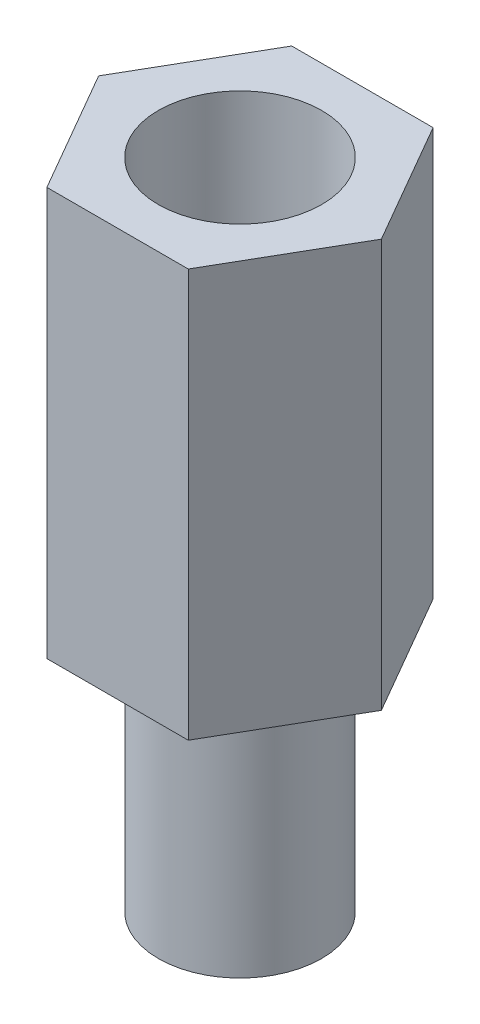
from build123d import *

# Parameters (mm, degrees)
SKETCH_2_R      = 2
EXTRUDE_1_DEPTH = 10
SKETCH_2_2_R    = 2
EXTRUDE_2_DEPTH = 6


with BuildPart() as part:
    # 草图2 → 凸台-拉伸1 (new body)
    with BuildSketch(Plane(origin=(0, 0, 0), x_dir=(1, 0, 0), z_dir=(0, 1, 0))):
        Polygon((3.464101615, 0), (1.732050808, 3), (-1.732050808, 3), (-3.464101615, 0), (-1.732050808, -3), (1.732050808, -3), align=None)
        Circle(SKETCH_2_R, mode=Mode.SUBTRACT)
    extrude(amount=EXTRUDE_1_DEPTH)


with BuildPart() as body_2:
    # 草图2<2> → 凸台-拉伸2 (new body)
    with BuildSketch(Plane(origin=(0, 0, 0), x_dir=(1, 0, 0), z_dir=(0, 1, 0))):
        Circle(SKETCH_2_2_R)
    extrude(amount=-EXTRUDE_2_DEPTH)


solid = Compound([part.part, body_2.part])
